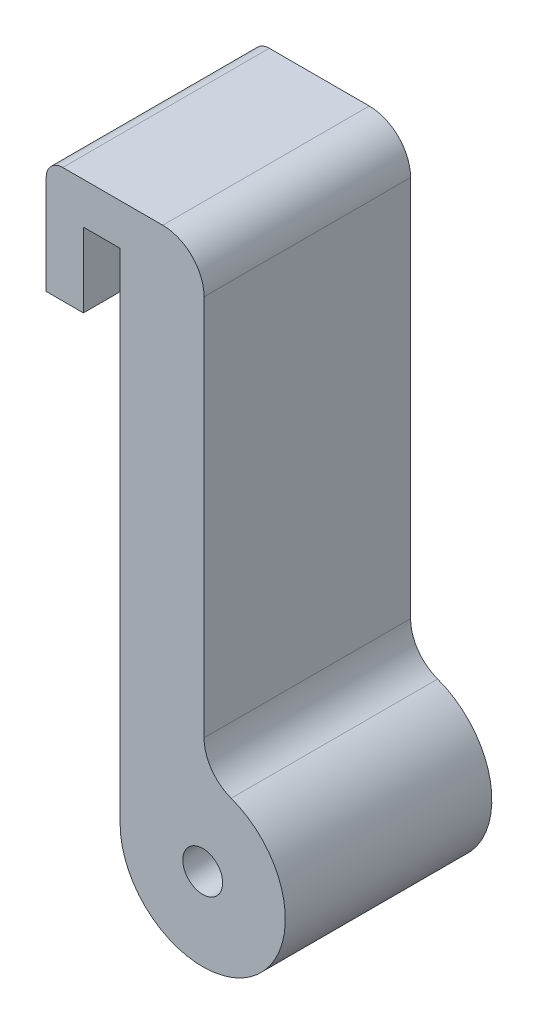
from build123d import *

# Parameters (mm, degrees)
SKETCH1_R           = 4.826
BOSS_EXTRUDE1_DEPTH = 50


with BuildPart() as part:
    # Sketch1 → Boss-Extrude1 (new body)
    with BuildSketch(Plane.XY):
        with BuildLine():
            Line((-20, 120.65), (-28.89, 120.65))
            Line((-28.89, 120.65), (-28.89, 102.65))
            Line((-28.89, 102.65), (-37.89, 102.65))
            Line((-37.89, 102.65), (-37.89, 126.65))
            ThreePointArc((-37.89, 126.65), (-36.718427125, 129.478427125), (-33.89, 130.65))
            Line((-33.89, 130.65), (-9.68, 130.65))
            ThreePointArc((-9.68, 130.65), (-2.608932188, 127.721067812), (0.32, 120.65))
            Line((0.32, 120.65), (0.32, 28.169089442))
            ThreePointArc((0.32, 28.169089442), (2.122439387, 22.441961017), (6.88, 18.779392961))
            ThreePointArc((6.88, 18.779392961), (11.454256851, -16.395121226), (-20, 0))
            Line((-20, 0), (-20, 120.65))
        make_face()
        Circle(SKETCH1_R, mode=Mode.SUBTRACT)
    extrude(amount=BOSS_EXTRUDE1_DEPTH)


solid = part.part
